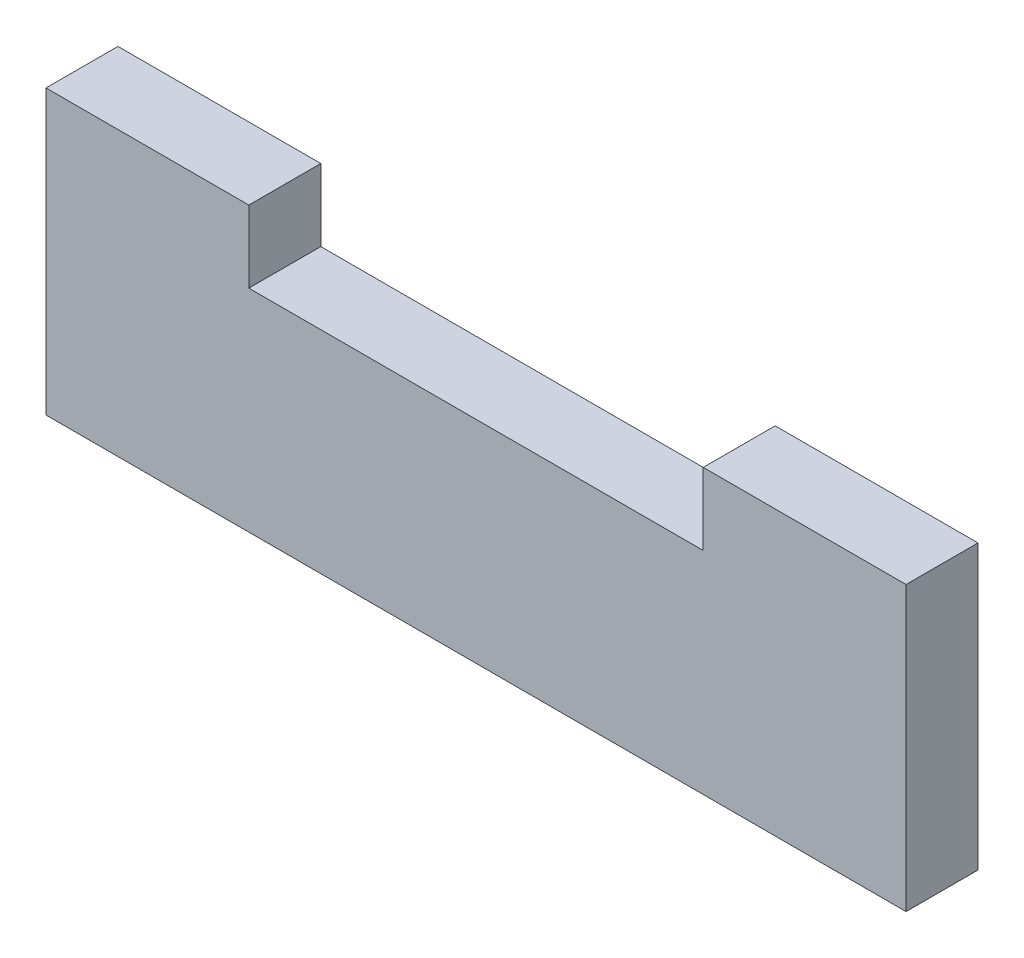
from build123d import *

# Parameters (mm, degrees)
BOSS_EXTRUDE1_DEPTH = 6.35


with BuildPart() as part:
    # Sketch1 → Boss-Extrude1 (new body)
    with BuildSketch(Plane.XY):
        Polygon((-37.95, 0), (37.95, 0), (37.95, 25), (20.05, 25), (20.05, 18.65), (-20.05, 18.65), (-20.05, 25), (-37.95, 25), align=None)
    extrude(amount=BOSS_EXTRUDE1_DEPTH)


solid = part.part
